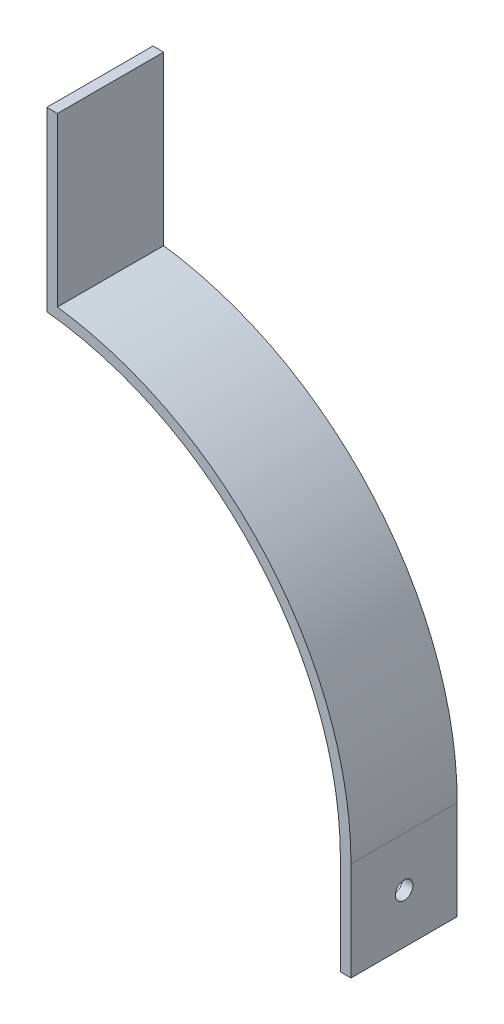
from build123d import *

# Parameters (mm, degrees)
BOSS_EXTRUDE1_DEPTH = 30
SKETCH2_R           = 2.5
CUT_EXTRUDE1_DEPTH  = 30


with BuildPart() as part:
    # Sketch1 → Boss-Extrude1 (new body)
    with BuildSketch(Plane.XY):
        with BuildLine():
            Line((0, 50), (0, 0))
            ThreePointArc((0, 0), (59.137285401, -30.145421821), (82.921098745, -92.115537233))
            Line((82.921098745, -92.115537233), (82.921098745, -120))
            Line((82.921098745, -120), (85.921098745, -120))
            Line((85.921098745, -120), (85.921098745, -92.115537233))
            ThreePointArc((85.921098745, -92.115537233), (62.264683971, -29.149857277), (3, 2.662090888))
            Line((3, 2.662090888), (3, 50))
            Line((3, 50), (0, 50))
        make_face()
    extrude(amount=BOSS_EXTRUDE1_DEPTH)

    # Sketch2 → Cut-Extrude1 (cut)
    with BuildSketch(Plane(origin=(85.921098745, 0, 0), x_dir=(0, 0, -1), z_dir=(1, 0, 0))):
        with Locations(Location((-15, -106.057768617, 0), (0, 0, 90))):
            Circle(SKETCH2_R)
    extrude(amount=-CUT_EXTRUDE1_DEPTH, mode=Mode.SUBTRACT)


solid = part.part
